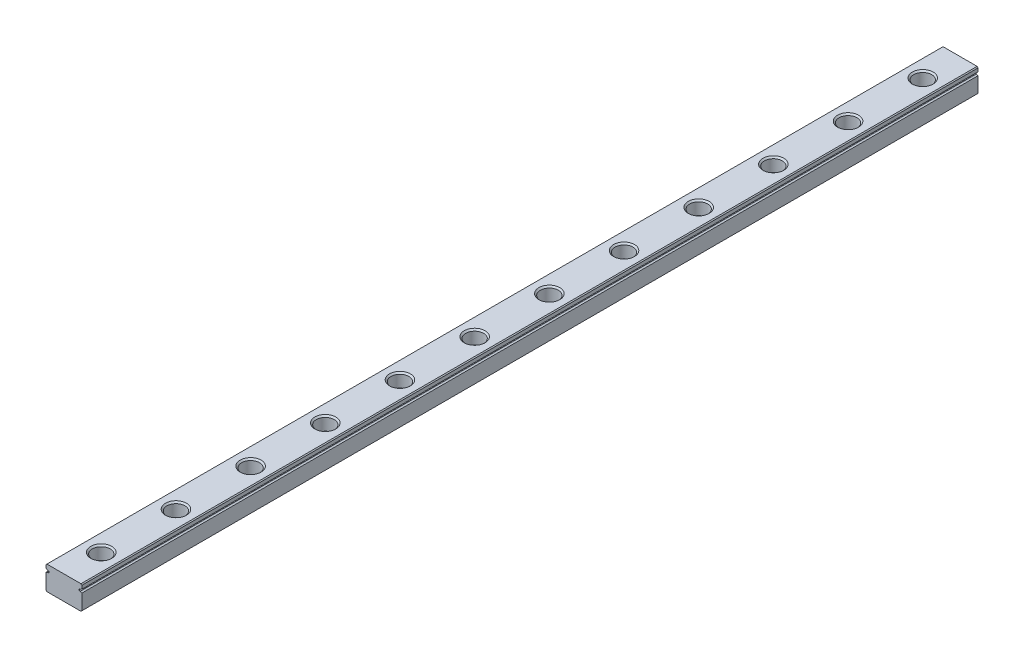
from build123d import *

# Parameters (mm, degrees)
BOSS_EXTRUDE1_DEPTH = 300
CHAMFER1_SIZE       = 0.3
LPATTERN1_COUNT     = 12
LPATTERN1_PITCH     = 25


with BuildPart() as part:
    # Sketch1 → Boss-Extrude1 (new body)
    with BuildSketch(Plane.XY):
        with BuildLine():
            Line((-6, 4), (6, 4))
            Line((6, 4), (6, 2.75))
            Line((6, 2.75), (6, 2.559016994))
            ThreePointArc((6, 2.559016994), (5.706107374, 2.475528258), (5.5, 2.25))
            Line((5.5, 2.25), (5, 2.25))
            Line((5, 2.25), (5, 1.75))
            Line((5, 1.75), (5.5, 1.75))
            ThreePointArc((5.5, 1.75), (5.706107374, 1.524471742), (6, 1.440983006))
            Line((6, 1.440983006), (6, 1.25))
            Line((6, 1.25), (6, -4))
            Line((6, -4), (-6, -4))
            Line((-6, -4), (-6, 1.25))
            Line((-6, 1.25), (-6, 1.440983006))
            ThreePointArc((-6, 1.440983006), (-5.706107374, 1.524471742), (-5.5, 1.75))
            Line((-5.5, 1.75), (-5, 1.75))
            Line((-5, 1.75), (-5, 2.25))
            Line((-5, 2.25), (-5.5, 2.25))
            ThreePointArc((-5.5, 2.25), (-5.706107374, 2.475528258), (-6, 2.559016994))
            Line((-6, 2.559016994), (-6, 2.75))
            Line((-6, 2.75), (-6, 4))
        make_face()
    extrude(amount=BOSS_EXTRUDE1_DEPTH)

    # Chamfer1
    chamfer1_edges = [part.edges().sort_by_distance(p)[0] for p in [
        (-6, 4, 150),
        (6, 4, 150),
        (6, -4, 150),
        (-6, -4, 150),
    ]]
    chamfer(chamfer1_edges, length=CHAMFER1_SIZE)

    # Sketch3 → M3 六角承窩頭蓋螺釘的柱孔1 (revolve, cut)
    with BuildSketch(Plane(origin=(0, 4, 12.5), x_dir=(0, 0, 1), z_dir=(1, 0, 0))):
        Polygon((0, 0), (0, 8), (2, 8), (1.75, 7.75), (1.75, 4.5), (3, 4.5), (3, 0.5), (3.5, 0), align=None)
    hole_wizard_m3_1 = revolve(axis=Axis((0, 10.35, 12.5), (0, -1, 0)), mode=Mode.SUBTRACT)

    # LPattern1: M3 六角承窩頭蓋螺釘的柱孔1 ×12
    with Locations(*[(0, 0, i * LPATTERN1_PITCH) for i in range(1, LPATTERN1_COUNT)]):
        add(hole_wizard_m3_1, mode=Mode.SUBTRACT)


solid = part.part
